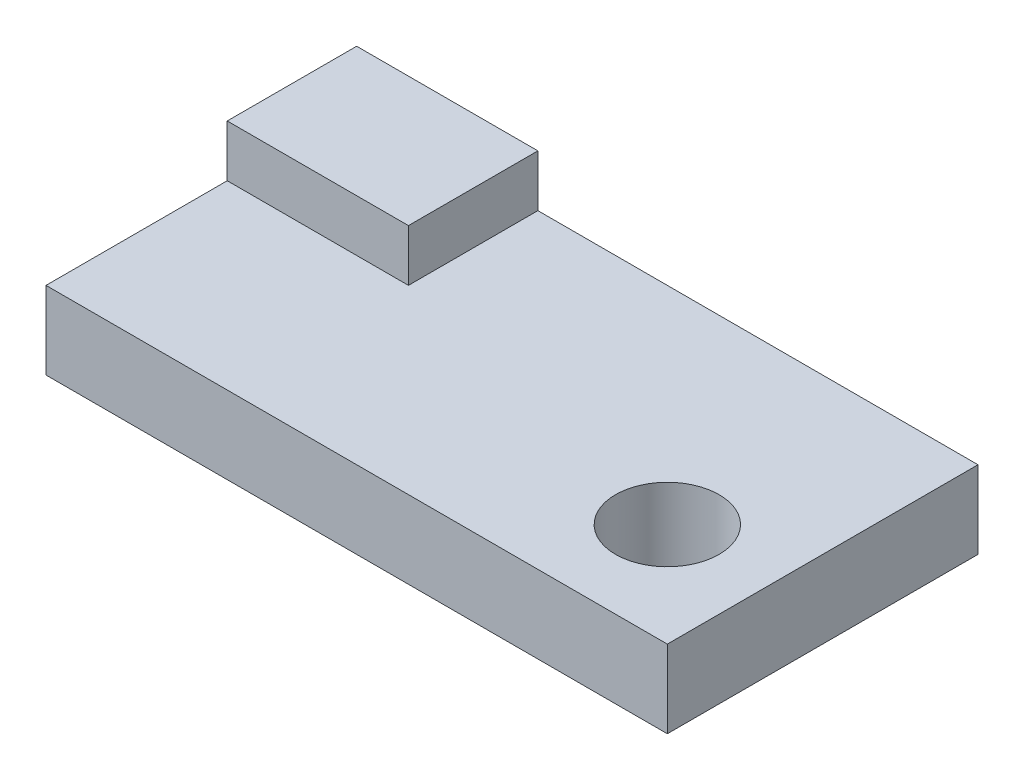
from build123d import *

# Parameters (mm, degrees)
CROQUIS1_W              = 120
CROQUIS1_H              = 60
CROQUIS1_R              = 10
SALIENTE_EXTRUIR1_DEPTH = 15
CROQUIS2_W              = 35
CROQUIS2_H              = 25
SALIENTE_EXTRUIR2_DEPTH = 10


with BuildPart() as part:
    # Croquis1 → Saliente-Extruir1 (new body)
    with BuildSketch(Plane(origin=(0, 0, 0), x_dir=(1, 0, 0), z_dir=(0, 1, 0))):
        Rectangle(CROQUIS1_W, CROQUIS1_H)
        with Locations(Location((40, -10, 0), (0, 0, 270))):
            Circle(CROQUIS1_R, mode=Mode.SUBTRACT)
    extrude(amount=SALIENTE_EXTRUIR1_DEPTH)

    # Croquis2 → Saliente-Extruir2 (add)
    with BuildSketch(Plane(origin=(0, 15, 0), x_dir=(1, 0, 0), z_dir=(0, 1, 0))):
        with Locations((-42.5, 17.5)):
            Rectangle(CROQUIS2_W, CROQUIS2_H)
    extrude(amount=SALIENTE_EXTRUIR2_DEPTH)


solid = part.part
